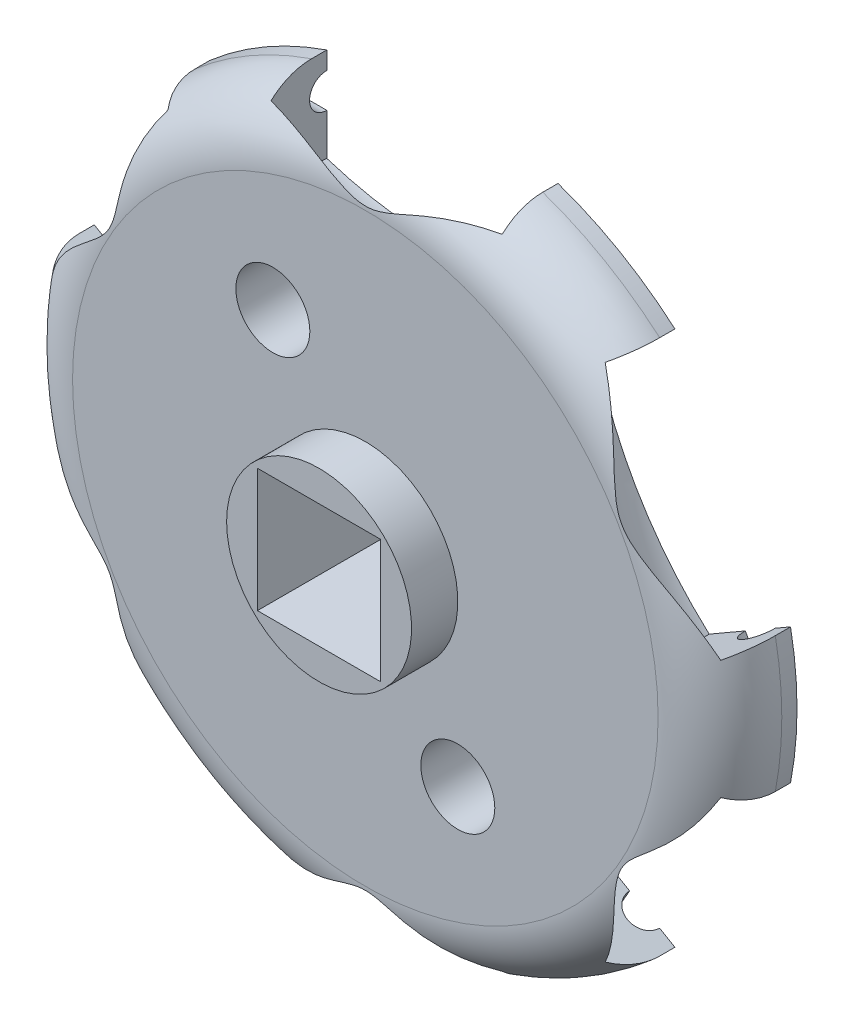
from build123d import *

# Parameters (mm, degrees)
SKETCH1_R           = 18.2626
BOSS_EXTRUDE1_DEPTH = 3.96875
FILLET1_R           = 3.18516
SKETCH2_R           = 1.905
SKETCH2_W           = 6.35
SKETCH2_H           = 6.35
CUT_EXTRUDE1_DEPTH  = 27.130367418
SKETCH6_R           = 0.889
CUT_EXTRUDE2_DEPTH  = 7.9375
CIRPATTERN1_COUNT   = 6
SKETCH7_R           = 4.7625
SKETCH7_W           = 6.35
SKETCH7_H           = 6.35
BOSS_EXTRUDE2_DEPTH = 2.38125


with BuildPart() as part:
    # Sketch1 → Boss-Extrude1 (new body)
    with BuildSketch(Plane.XY):
        Circle(SKETCH1_R)
    extrude(amount=BOSS_EXTRUDE1_DEPTH)

    # Fillet1
    fillet1_edges = [part.edges().sort_by_distance(p)[0] for p in [
        (-18.2626, 0, 3.96875),
    ]]
    fillet(fillet1_edges, radius=FILLET1_R)

    # Sketch2 → Cut-Extrude1 (cut, through all)
    with BuildSketch(Plane.XY.offset(3.96875)):
        with Locations((-4.7625, 8.248891971)):
            Circle(SKETCH2_R)
        with Locations((4.7625, -8.248891971)):
            Circle(SKETCH2_R)
        Rectangle(SKETCH2_W, SKETCH2_H)
    extrude(amount=-CUT_EXTRUDE1_DEPTH, mode=Mode.SUBTRACT)

    # Sketch5 → Cut-Revolve1 (revolve, cut)
    with BuildSketch(Plane.XY):
        with BuildLine():
            Line((-5.953125, 15.46225), (5.953125, 15.46225))
            Line((5.953125, 15.46225), (5.953125, 18.496596004))
            ThreePointArc((5.953125, 18.496596004), (0, 19.431), (-5.953125, 18.496596004))
            Line((-5.953125, 18.496596004), (-5.953125, 15.46225))
        make_face()
    cut_revolve1 = revolve(axis=Axis((-5.953125, 15.46225, 0), (-1, 0, 0)), mode=Mode.SUBTRACT)

    # Sketch6 → Cut-Extrude2 (cut, symmetric)
    with BuildSketch(Plane(origin=(0, 0, 0), x_dir=(0, 0, -1), z_dir=(1, 0, 0))):
        with Locations((0, 15.46225)):
            Circle(SKETCH6_R)
    cut_extrude2 = extrude(amount=CUT_EXTRUDE2_DEPTH, both=True, mode=Mode.SUBTRACT)

    # CirPattern1: Cut-Revolve1, Cut-Extrude2 ×6 about axis
    cirpattern1_axis = Axis((0, 0, 0), (0, 0, 1))
    add([cut_revolve1.rotate(cirpattern1_axis, i * 360 / CIRPATTERN1_COUNT) for i in range(1, CIRPATTERN1_COUNT)], mode=Mode.SUBTRACT)
    add([cut_extrude2.rotate(cirpattern1_axis, i * 360 / CIRPATTERN1_COUNT) for i in range(1, CIRPATTERN1_COUNT)], mode=Mode.SUBTRACT)

    # Sketch7 → Boss-Extrude2 (add)
    with BuildSketch(Plane.XY.offset(3.96875)):
        with Locations(Location((0, 0, 0), (0, 0, 180))):
            Circle(SKETCH7_R)
        Rectangle(SKETCH7_W, SKETCH7_H, mode=Mode.SUBTRACT)
    extrude(amount=BOSS_EXTRUDE2_DEPTH)


solid = part.part
